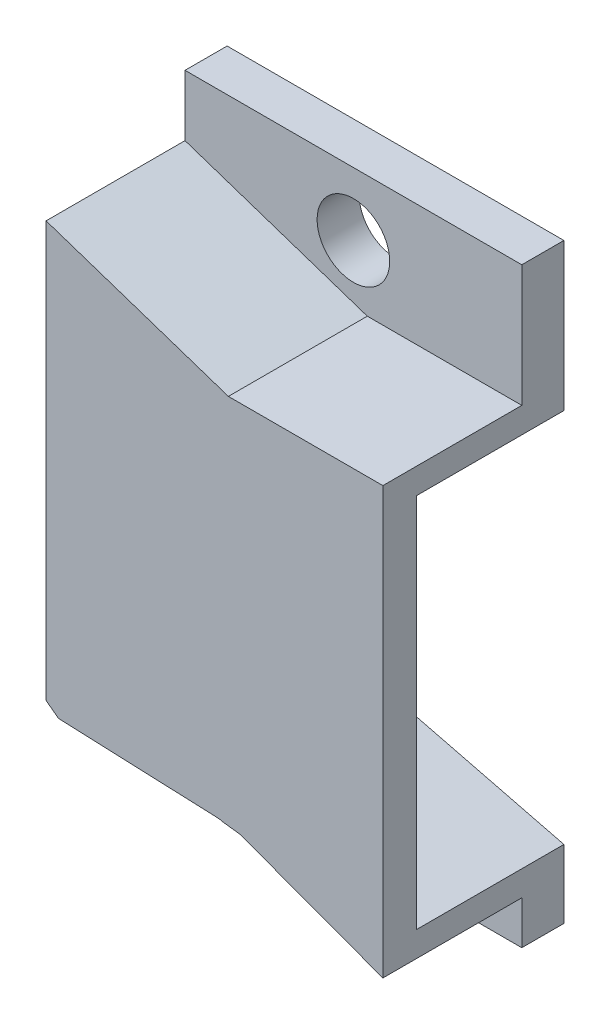
from build123d import *

# Parameters (mm, degrees)
ESQUISSE1_W             = 16
ESQUISSE1_H             = 28.1
ESQUISSE1_R             = 1.725
BOSS_EXTRU_1_DEPTH      = 8.6
ESQUISSE2_W             = 16
ESQUISSE2_H             = 14.6
ENL_V_MAT_EXTRU_2_DEPTH = 7
ENL_V_MAT_EXTRU_5_DEPTH = 16
ENL_V_MAT_EXTRU_6_DEPTH = 7
ENL_V_START             = -2
ENL_V_MAT_EXTRU_9_DEPTH = 18


with BuildPart() as part:
    # Esquisse1 → Boss.-Extru.1 (new body)
    with BuildSketch(Plane.XY):
        with Locations((-5.445538763, -0.094706778)):
            Rectangle(ESQUISSE1_W, ESQUISSE1_H)
        with Locations(Location((-5.445538763, 10.955293222, 0), (0, 0, 180))):
            Circle(ESQUISSE1_R, mode=Mode.SUBTRACT)
        with Locations(Location((-5.445538763, -11.144706778, 0), (0, 0, 180))):
            Circle(ESQUISSE1_R, mode=Mode.SUBTRACT)
    extrude(amount=BOSS_EXTRU_1_DEPTH)

    # Esquisse2 → Enlèv. mat.-Extru.2 (cut)
    with BuildSketch(Plane(origin=(0, 0, 0), x_dir=(-1, 0, 0), z_dir=(0, 0, -1))):
        with Locations((5.445538763, -0.344706778)):
            Rectangle(ESQUISSE2_W, ESQUISSE2_H)
    extrude(amount=-ENL_V_MAT_EXTRU_2_DEPTH, mode=Mode.SUBTRACT)

    # Esquisse4 → Enlèv. mat.-Extru.5 (cut)
    with BuildSketch(Plane(origin=(0, 0, 0), x_dir=(-1, 0, 0), z_dir=(0, 0, -1))):
        Polygon((8.103346265, -14.144706778), (13.445538763, -14.144706778), (13.445538763, -8.673372576), (6.156041758, -14.144706778), align=None)
    extrude(amount=-ENL_V_MAT_EXTRU_5_DEPTH, mode=Mode.SUBTRACT)

    # Esquisse5 → Enlèv. mat.-Extru.6 (cut)
    with BuildSketch(Plane(origin=(0, 0, 0), x_dir=(-1, 0, 0), z_dir=(0, 0, -1))):
        Polygon((-2.554461237, -7.644706778), (-2.554461237, -10.894706778), (10.445538763, -7.644706778), align=None)
        Polygon((13.445538763, 6.955293222), (13.445538763, 9.910651633), (3.808396856, 6.955293222), align=None)
    extrude(amount=-ENL_V_MAT_EXTRU_6_DEPTH, mode=Mode.SUBTRACT)

    # Esquisse6 → Enlèv. mat.-Extru.9 (cut)
    with BuildSketch(Plane(origin=(0, 0, 0), x_dir=(-1, 0, 0), z_dir=(0, 0, -1)).offset(ENL_V_START)):
        Polygon((-2.554461237, 13.955293222), (-2.554461237, 8.169439353), (4.78538363, 8.169439353), (13.445538763, 11.062366287), (13.445538763, 13.955293222), align=None)
        with BuildLine():
            Line((6.156041758, -14.144706778), (12.854526116, -9.116973515))
            Line((12.854526116, -9.116973515), (5.445538763, -9.419706778))
            ThreePointArc((5.445538763, -9.419706778), (6.66529796, -9.924947581), (7.170538763, -11.144706778))
            ThreePointArc((7.170538763, -11.144706778), (4.386718709, -12.506516271), (5.020364742, -9.472925677))
            Line((5.020364742, -9.472925677), (4.233785553, -9.571381546))
            Line((4.233785553, -9.571381546), (-2.554461237, -12.089845576))
            Line((-2.554461237, -12.089845576), (-2.554461237, -14.144706778))
            Line((-2.554461237, -14.144706778), (6.156041758, -14.144706778))
        make_face()
    extrude(amount=-ENL_V_MAT_EXTRU_9_DEPTH, mode=Mode.SUBTRACT)


solid = part.part
